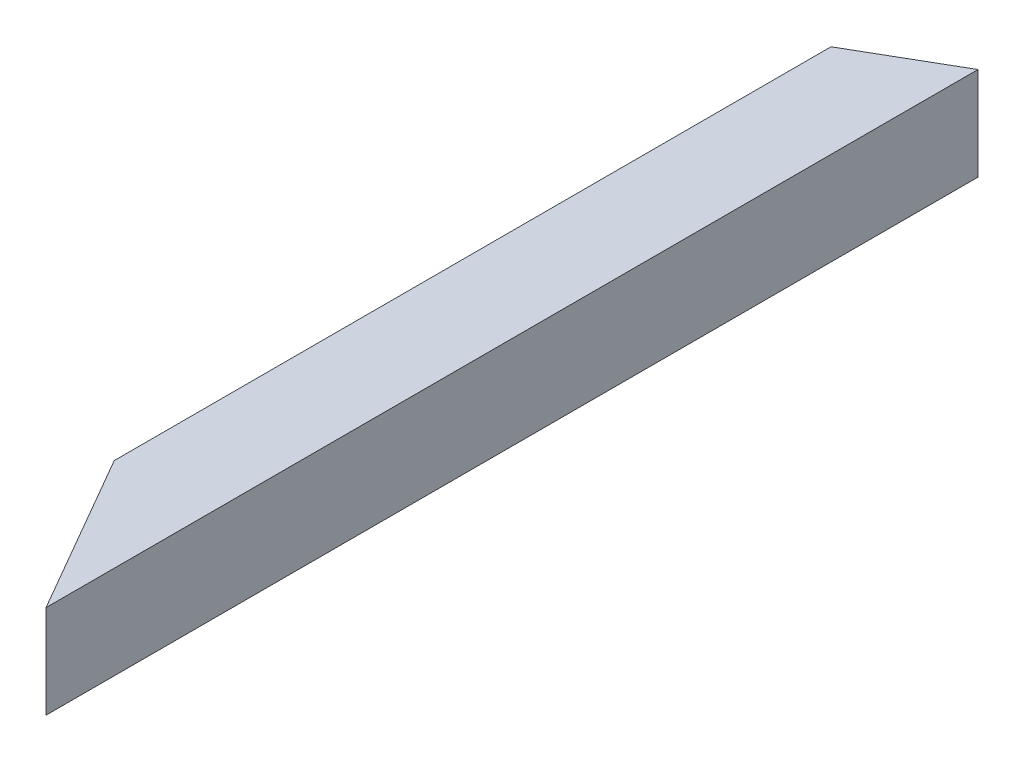
from build123d import *

# Parameters (mm, degrees)
SKETCH_1_W          = 20
SKETCH_1_H          = 20
SKETCH_1_W_2        = 18
SKETCH_1_H_2        = 18
EXTRUDE_1_DEPTH     = 200
CUT_EXTRUDE_1_DEPTH = 300


with BuildPart() as part:
    # 草图1 → 凸台-拉伸1 (new body)
    with BuildSketch(Plane.XY):
        with Locations((10, 10)):
            Rectangle(SKETCH_1_W, SKETCH_1_H)
        with Locations((10, 10)):
            Rectangle(SKETCH_1_W_2, SKETCH_1_H_2, mode=Mode.SUBTRACT)
    extrude(amount=EXTRUDE_1_DEPTH)

    # 草图2 → 切除-拉伸1 (cut)
    with BuildSketch(Plane(origin=(0, 20, 0), x_dir=(1, 0, 0), z_dir=(0, 1, 0))):
        Polygon((20, 0), (0, -11.547005384), (0, 0), align=None)
        Polygon((0, -165.358983849), (20, -200), (0, -200), align=None)
    extrude(amount=-CUT_EXTRUDE_1_DEPTH, mode=Mode.SUBTRACT)


solid = part.part
